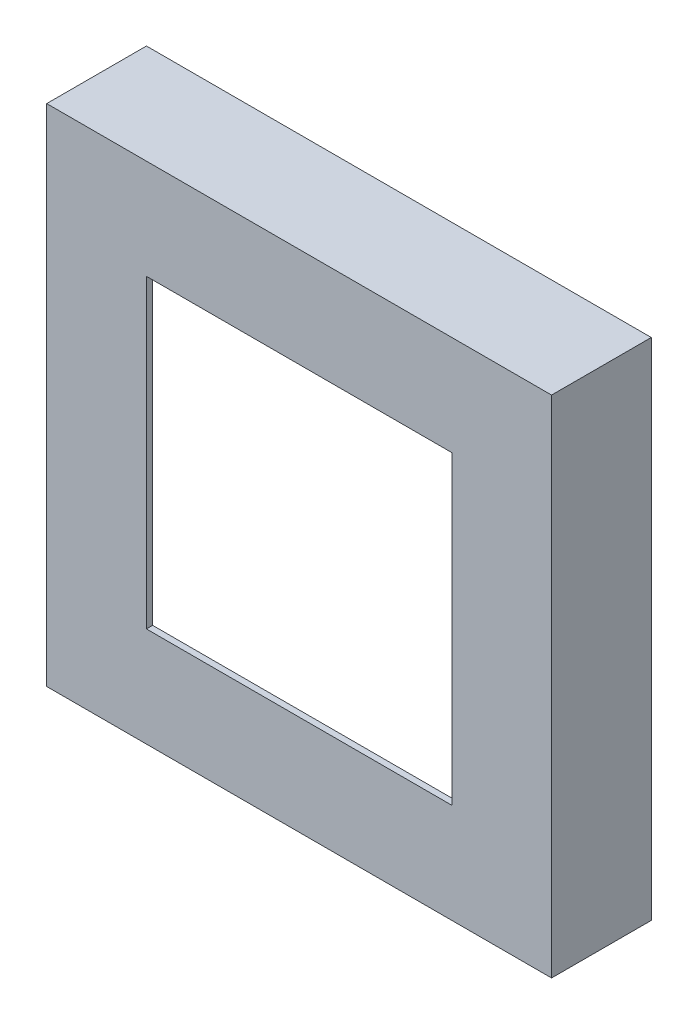
from build123d import *

# Parameters (mm, degrees)
SKETCH1_W           = 81
SKETCH1_H           = 81
SKETCH1_W_2         = 79
SKETCH1_H_2         = 79
BOSS_EXTRUDE1_DEPTH = 15
SKETCH2_W           = 81
SKETCH2_H           = 81
SKETCH2_W_2         = 49
SKETCH2_H_2         = 49
BOSS_EXTRUDE2_DEPTH = 1


with BuildPart() as part:
    # Sketch1 → Boss-Extrude1 (new body)
    with BuildSketch(Plane.XY):
        with Locations((39.5, 39.5)):
            Rectangle(SKETCH1_W, SKETCH1_H)
        with Locations((39.5, 39.5)):
            Rectangle(SKETCH1_W_2, SKETCH1_H_2, mode=Mode.SUBTRACT)
    extrude(amount=BOSS_EXTRUDE1_DEPTH)

    # Sketch2 → Boss-Extrude2 (add)
    with BuildSketch(Plane.XY.offset(15)):
        with Locations((39.5, 39.5)):
            Rectangle(SKETCH2_W, SKETCH2_H)
        with Locations((39.5, 39.5)):
            Rectangle(SKETCH2_W_2, SKETCH2_H_2, mode=Mode.SUBTRACT)
    extrude(amount=BOSS_EXTRUDE2_DEPTH)


solid = part.part
